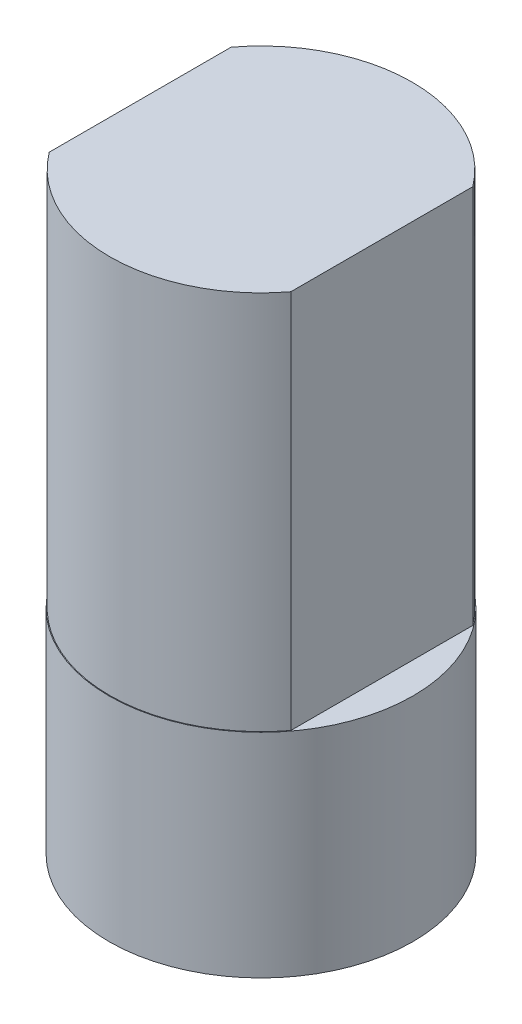
from build123d import *

# Parameters (mm, degrees)
SKETCH2_R           = 5
BOSS_EXTRUDE1_DEPTH = 7
BOSS_EXTRUDE2_DEPTH = 12.5


with BuildPart() as part:
    # Sketch2 → Boss-Extrude1 (new body)
    with BuildSketch(Plane(origin=(0, 0, 0), x_dir=(1, 0, 0), z_dir=(0, 1, 0))):
        with Locations(Location((0, 0, 0), (0, 0, 270))):
            Circle(SKETCH2_R)
    extrude(amount=BOSS_EXTRUDE1_DEPTH)

    # Sketch3 → Boss-Extrude2 (add)
    with BuildSketch(Plane(origin=(0, 7, 0), x_dir=(1, 0, 0), z_dir=(0, 1, 0))):
        with BuildLine():
            Line((-3.975, 2.99165506), (-3.975, -2.99165506))
            ThreePointArc((-3.975, -2.99165506), (0, -4.975), (3.975, -2.99165506))
            Line((3.975, -2.99165506), (3.975, 2.99165506))
            ThreePointArc((3.975, 2.99165506), (0, 4.975), (-3.975, 2.99165506))
        make_face()
    extrude(amount=BOSS_EXTRUDE2_DEPTH)


solid = part.part
